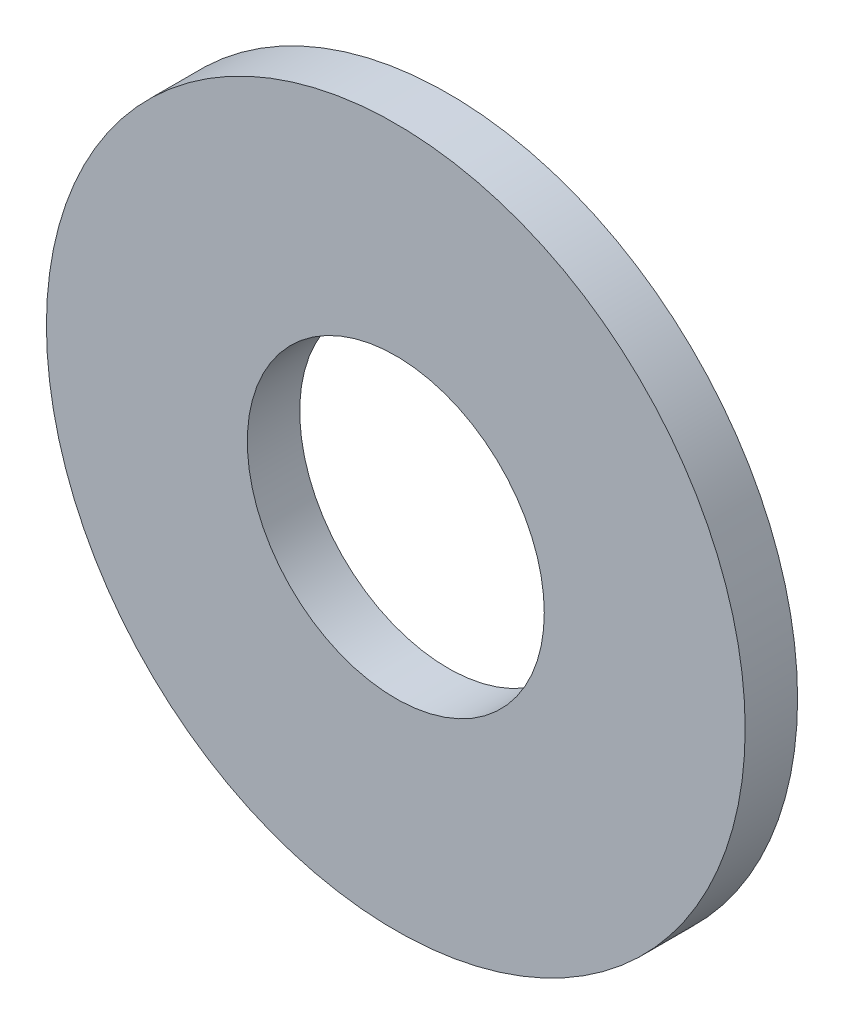
from build123d import *

# Parameters (mm, degrees)
SKETCH1_R    = 2
SKETCH1_R_2  = 0.85
WASHER_DEPTH = 0.3


with BuildPart() as part:
    # Sketch1 → Washer (new body)
    with BuildSketch(Plane.XY):
        Circle(SKETCH1_R)
        Circle(SKETCH1_R_2, mode=Mode.SUBTRACT)
    extrude(amount=WASHER_DEPTH)


solid = part.part
